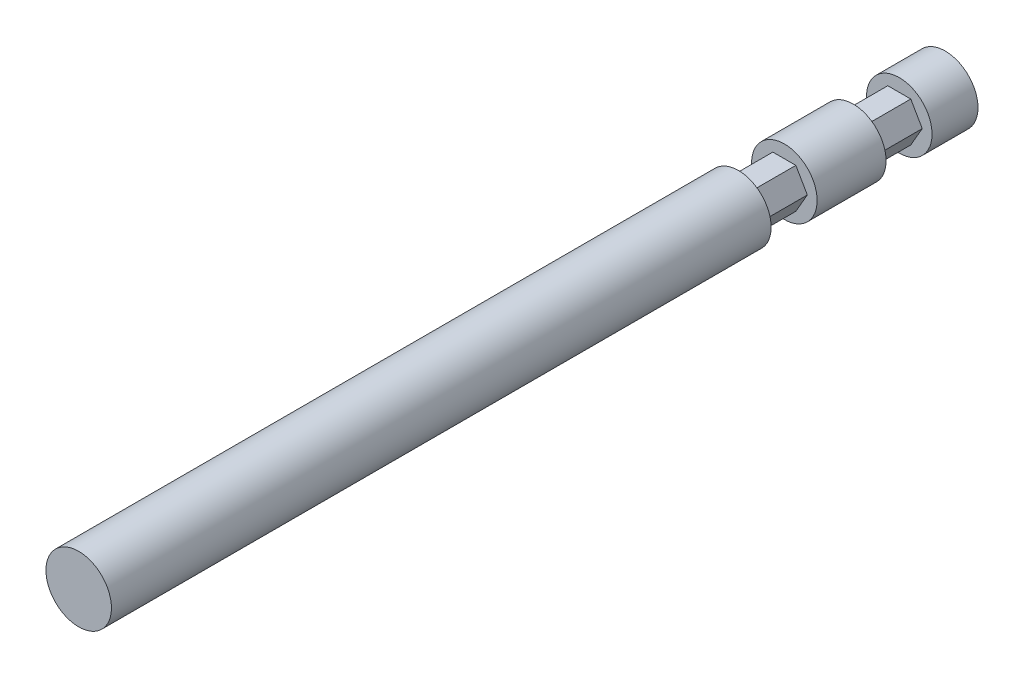
from build123d import *

# Parameters (mm, degrees)
SKETCH_1_R      = 2.85
EXTRUDE_1_DEPTH = 4
EXTRUDE_2_DEPTH = 4
SKETCH_3_R      = 2.85
EXTRUDE_3_DEPTH = 6
EXTRUDE_4_DEPTH = 4
SKETCH_6_R      = 2.85
EXTRUDE_5_DEPTH = 57.4


with BuildPart() as part:
    # 草图1 → 凸台-拉伸1 (new body)
    with BuildSketch(Plane.XY):
        Circle(SKETCH_1_R)
    extrude(amount=EXTRUDE_1_DEPTH)

    # 草图2 → 凸台-拉伸2 (add)
    with BuildSketch(Plane.XY.offset(4)):
        Polygon((2, 0), (1, 1.732050808), (-1, 1.732050808), (-2, 0), (-1, -1.732050808), (1, -1.732050808), align=None)
    extrude(amount=EXTRUDE_2_DEPTH)

    # 草图3 → 凸台-拉伸3 (add)
    with BuildSketch(Plane.XY.offset(8)):
        Circle(SKETCH_3_R)
    extrude(amount=EXTRUDE_3_DEPTH)

    # 草图4 → 凸台-拉伸4 (add)
    with BuildSketch(Plane.XY.offset(14)):
        Polygon((2, 0), (1, 1.732050808), (-1, 1.732050808), (-2, 0), (-1, -1.732050808), (1, -1.732050808), align=None)
    extrude(amount=EXTRUDE_4_DEPTH)

    # 草图6 → 凸台-拉伸5 (add)
    with BuildSketch(Plane.XY.offset(18)):
        Circle(SKETCH_6_R)
    extrude(amount=EXTRUDE_5_DEPTH)


solid = part.part
